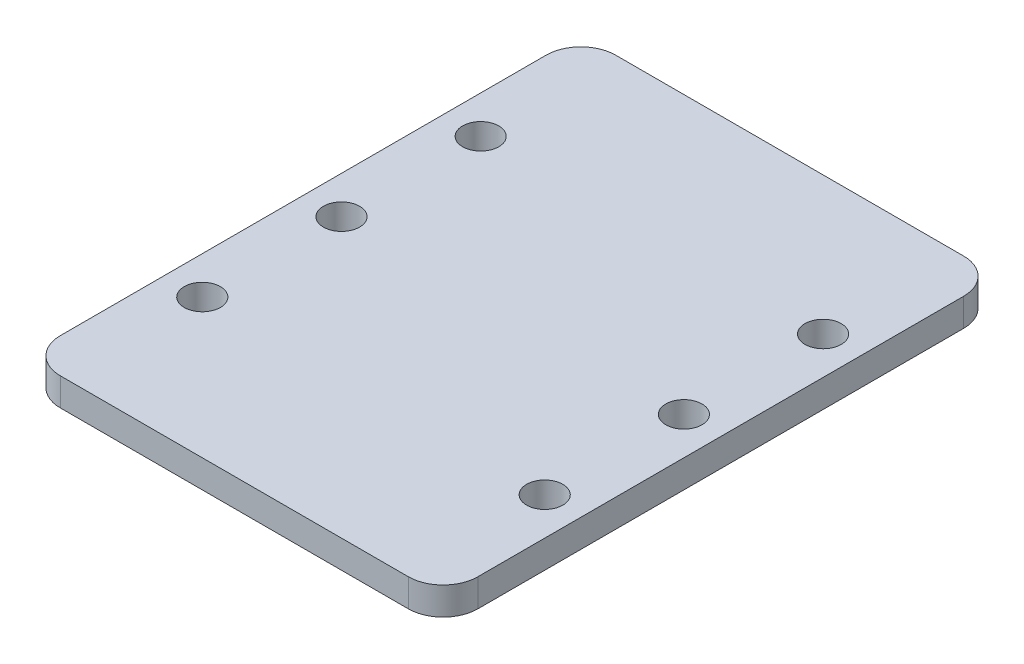
from build123d import *

# Parameters (mm, degrees)
SKETCH1_W           = 38.1
SKETCH1_H           = 50.673
SKETCH1_R           = 1.651
BOSS_EXTRUDE1_DEPTH = 2.54
FILLET1_R           = 3.175


with BuildPart() as part:
    # Sketch1 → Boss-Extrude1 (new body)
    with BuildSketch(Plane(origin=(0, 0, 0), x_dir=(1, 0, 0), z_dir=(0, 1, 0))):
        with Locations((-95.25, 68.3895)):
            Rectangle(SKETCH1_W, SKETCH1_H)
        with Locations(Location((-110.871, 81.153, 0), (0, 0, 270))):
            Circle(SKETCH1_R, mode=Mode.SUBTRACT)
        with Locations(Location((-110.871, 68.453, 0), (0, 0, 270))):
            Circle(SKETCH1_R, mode=Mode.SUBTRACT)
        with Locations(Location((-110.871, 55.753, 0), (0, 0, 270))):
            Circle(SKETCH1_R, mode=Mode.SUBTRACT)
        with Locations(Location((-79.629, 81.153, 0), (0, 0, 90))):
            Circle(SKETCH1_R, mode=Mode.SUBTRACT)
        with Locations(Location((-79.629, 68.453, 0), (0, 0, 90))):
            Circle(SKETCH1_R, mode=Mode.SUBTRACT)
        with Locations(Location((-79.629, 55.753, 0), (0, 0, 90))):
            Circle(SKETCH1_R, mode=Mode.SUBTRACT)
    extrude(amount=BOSS_EXTRUDE1_DEPTH)

    # Fillet1
    fillet1_edges = [part.edges().sort_by_distance(p)[0] for p in [
        (-76.2, 1.27, -43.053),
        (-114.3, 1.27, -43.053),
        (-114.3, 1.27, -93.726),
        (-76.2, 1.27, -93.726),
    ]]
    fillet(fillet1_edges, radius=FILLET1_R)


solid = part.part
